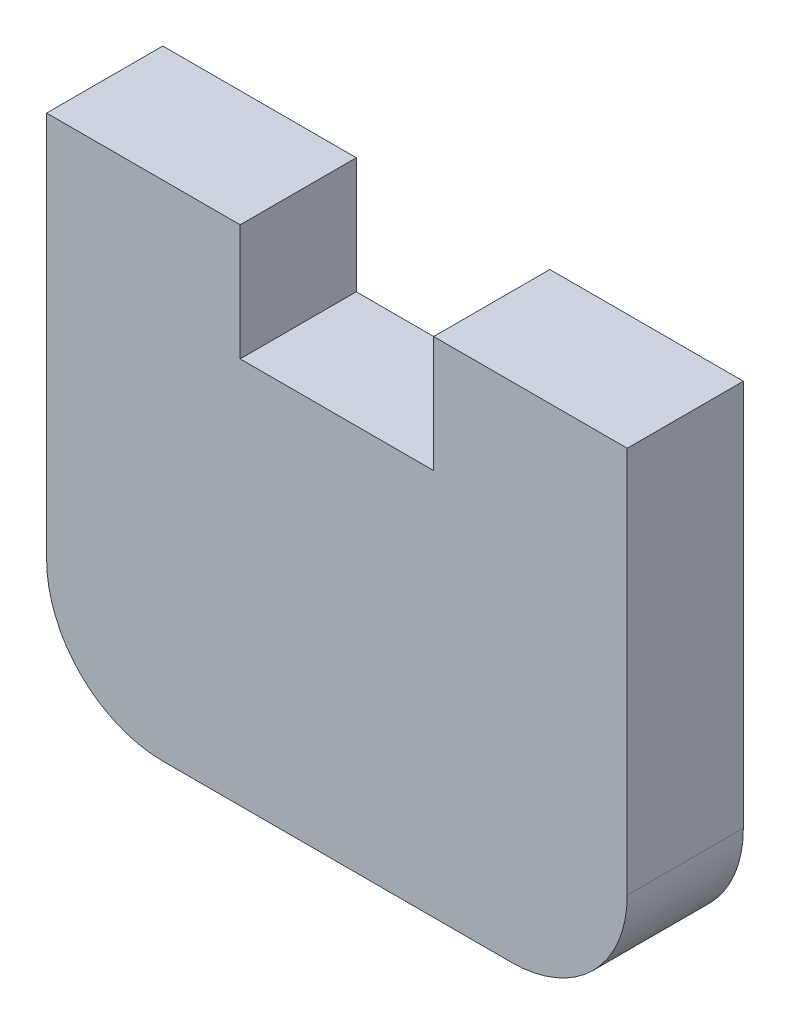
from build123d import *

# Parameters (mm, degrees)
SALIENTE_EXTRUIR1_DEPTH = 3


with BuildPart() as part:
    # Croquis1 → Saliente-Extruir1 (new body)
    with BuildSketch(Plane.XY):
        with BuildLine():
            Line((0, 22.001027223), (-5, 22.001027223))
            Line((-5, 22.001027223), (-5, 12.001027223))
            ThreePointArc((-5, 12.001027223), (-4.121320344, 9.87970688), (-2, 9.001027223))
            Line((-2, 9.001027223), (7, 9.001027223))
            ThreePointArc((7, 9.001027223), (9.121320344, 9.87970688), (10, 12.001027223))
            Line((10, 12.001027223), (10, 19.001027223))
            Line((10, 19.001027223), (10, 22.001027223))
            Line((10, 22.001027223), (5, 22.001027223))
            Line((5, 22.001027223), (5, 19.001027223))
            Line((5, 19.001027223), (0, 19.001027223))
            Line((0, 19.001027223), (0, 22.001027223))
        make_face()
    extrude(amount=SALIENTE_EXTRUIR1_DEPTH)


solid = part.part
